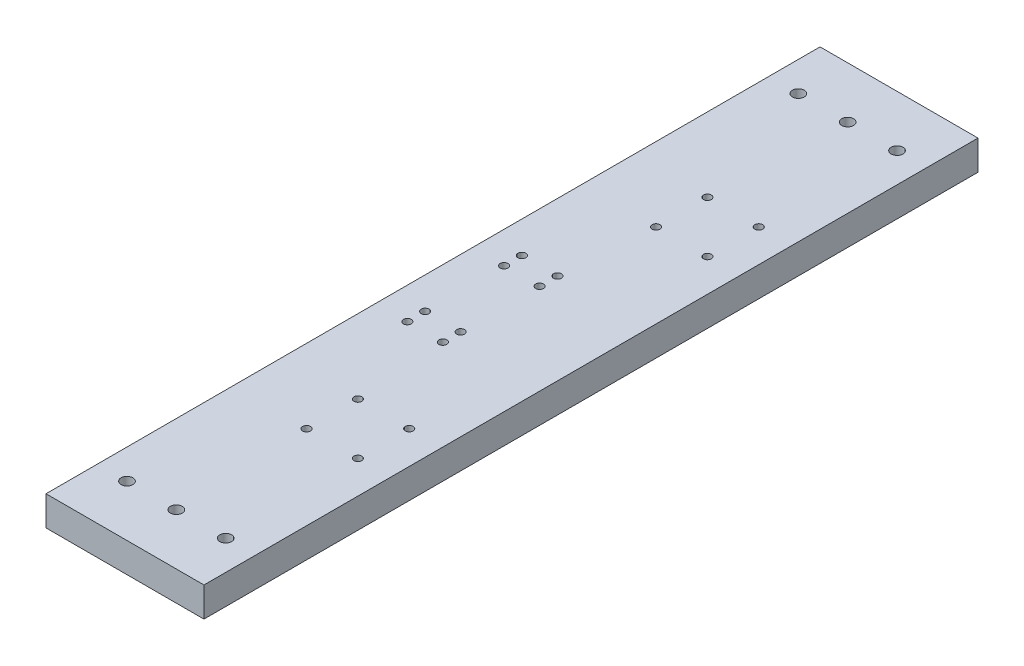
from build123d import *

# Parameters (mm, degrees)
SKETCH_1_W          = 80
SKETCH_1_H          = 15
EXTRUDE_1_DEPTH     = 392
SKETCH_2_R          = 3
CUT_EXTRUDE_1_DEPTH = 401.36108702
SKETCH_3_R          = 2
CUT_EXTRUDE_2_DEPTH = 401.36108702
SKETCH_4_R          = 2
CUT_EXTRUDE_3_DEPTH = 401.36108702


with BuildPart() as part:
    # 草图1 → 凸台-拉伸1 (new body)
    with BuildSketch(Plane.XY):
        with Locations((40, 7.5)):
            Rectangle(SKETCH_1_W, SKETCH_1_H)
    extrude(amount=EXTRUDE_1_DEPTH)

    # 草图2 → 切除-拉伸1 (cut, through all)
    with BuildSketch(Plane(origin=(0, 15, 0), x_dir=(1, 0, 0), z_dir=(0, 1, 0))):
        with Locations(Location((65, -26, 0), (0, 0, 270))):
            Circle(SKETCH_2_R)
        with Locations(Location((40, -26, 0), (0, 0, 270))):
            Circle(SKETCH_2_R)
        with Locations(Location((15, -26, 0), (0, 0, 270))):
            Circle(SKETCH_2_R)
        with Locations(Location((15, -366, 0), (0, 0, 90))):
            Circle(SKETCH_2_R)
        with Locations(Location((40, -366, 0), (0, 0, 90))):
            Circle(SKETCH_2_R)
        with Locations(Location((65, -366, 0), (0, 0, 90))):
            Circle(SKETCH_2_R)
    extrude(amount=-CUT_EXTRUDE_1_DEPTH, mode=Mode.SUBTRACT)

    # 草图3 → 切除-拉伸2 (cut, through all)
    with BuildSketch(Plane(origin=(0, 0, 0), x_dir=(-1, 0, 0), z_dir=(0, -1, 0))):
        with Locations(Location((-34, -216, 0), (0, 0, 90))):
            Circle(SKETCH_3_R)
        with Locations(Location((-34, -225, 0), (0, 0, 90))):
            Circle(SKETCH_3_R)
        with Locations(Location((-16, -225, 0), (0, 0, 90))):
            Circle(SKETCH_3_R)
        with Locations(Location((-16, -216, 0), (0, 0, 90))):
            Circle(SKETCH_3_R)
        with Locations(Location((-16, -176, 0), (0, 0, 270))):
            Circle(SKETCH_3_R)
        with Locations(Location((-16, -167, 0), (0, 0, 270))):
            Circle(SKETCH_3_R)
        with Locations(Location((-34, -167, 0), (0, 0, 270))):
            Circle(SKETCH_3_R)
        with Locations(Location((-34, -176, 0), (0, 0, 270))):
            Circle(SKETCH_3_R)
    extrude(amount=-CUT_EXTRUDE_2_DEPTH, mode=Mode.SUBTRACT)

    # 草图4 → 切除-拉伸3 (cut, through all)
    with BuildSketch(Plane(origin=(0, 15, 0), x_dir=(1, 0, 0), z_dir=(0, 1, 0))):
        with Locations(Location((63.45, -94.5, 0), (0, 0, 270))):
            Circle(SKETCH_4_R)
        with Locations(Location((37.45, -94.5, 0), (0, 0, 270))):
            Circle(SKETCH_4_R)
        with Locations(Location((37.45, -120.5, 0), (0, 0, 270))):
            Circle(SKETCH_4_R)
        with Locations(Location((63.45, -120.5, 0), (0, 0, 270))):
            Circle(SKETCH_4_R)
        with Locations(Location((63.45, -271.5, 0), (0, 0, 90))):
            Circle(SKETCH_4_R)
        with Locations(Location((37.45, -271.5, 0), (0, 0, 90))):
            Circle(SKETCH_4_R)
        with Locations(Location((37.45, -297.5, 0), (0, 0, 90))):
            Circle(SKETCH_4_R)
        with Locations(Location((63.45, -297.5, 0), (0, 0, 90))):
            Circle(SKETCH_4_R)
    extrude(amount=-CUT_EXTRUDE_3_DEPTH, mode=Mode.SUBTRACT)


solid = part.part
